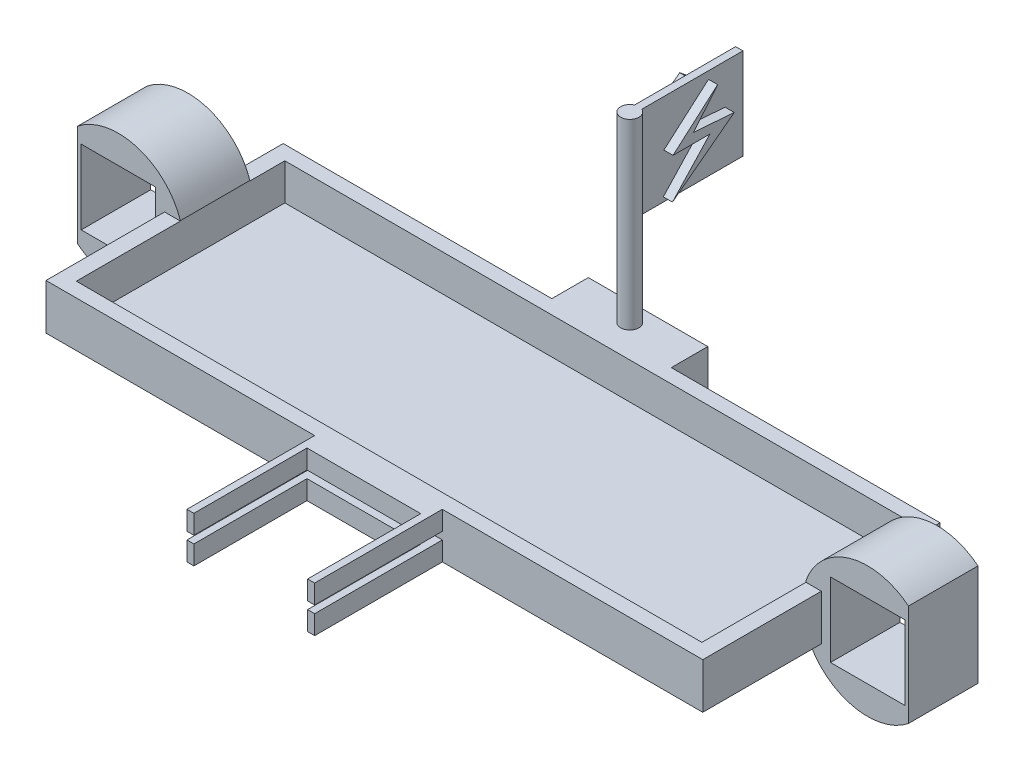
from build123d import *

# Parameters (mm, degrees)
SKETCH1_W            = 180
SKETCH1_H            = 65
SKETCH1_W_2          = 171.45
SKETCH1_H_2          = 57.15
BOSS_EXTRUDE1_DEPTH  = 10
SKETCH2_W            = 180
SKETCH2_H            = 65
BOSS_EXTRUDE2_DEPTH  = 2.5
SKETCH3_W            = 19.05
SKETCH3_H            = 4.647704017
SKETCH3_H_2          = 3.172295983
BOSS_EXTRUDE3_DEPTH  = 2.5
SKETCH4_W            = 2.440634246
SKETCH4_H            = 20.32
BOSS_EXTRUDE4_DEPTH  = 19.05
SKETCH5_W            = 19.05
SKETCH5_H            = 25.298590684
BOSS_EXTRUDE5_DEPTH  = 2.5
BOSS_EXTRUDE6_DEPTH  = 19.05
SKETCH7_W            = 35
SKETCH7_H            = 5.223578232
BOSS_EXTRUDE7_DEPTH  = 4
SKETCH8_W            = 1.900028328
SKETCH8_H            = 5.223578232
SKETCH8_W_2          = 1.933775308
BOSS_EXTRUDE8_DEPTH  = 35
SKETCH9_W            = 25.32
SKETCH9_H            = 2.501981816
BOSS_EXTRUDE9_DEPTH  = 19.05
SKETCH10_W           = 20.346164675
SKETCH10_H           = 20.35236298
SKETCH10_W_2         = 20.379365754
SKETCH10_H_2         = 20.32
BOSS_EXTRUDE10_DEPTH = 19.05
SKETCH11_W           = 21.053847509
SKETCH11_H           = 26.24333769
SKETCH11_W_2         = 20.65238494
SKETCH11_H_2         = 27.151183987
CUT_EXTRUDE1_DEPTH   = 219.146485719
SKETCH12_W           = 32.74513921
SKETCH12_H           = 12.5
BOSS_EXTRUDE11_DEPTH = 10
SKETCH13_R           = 2.5
BOSS_EXTRUDE12_DEPTH = 50
BOSS_EXTRUDE13_START = -25
BOSS_EXTRUDE13_DEPTH = 25
BOSS_EXTRUDE14_DEPTH = 2.5
BOSS_EXTRUDE15_DEPTH = 2.5


with BuildPart() as part:
    # Sketch1 → Boss-Extrude1 (new body)
    with BuildSketch(Plane(origin=(0, 0, 0), x_dir=(1, 0, 0), z_dir=(0, 1, 0))):
        with Locations((85.674229947, 28.51722294)):
            Rectangle(SKETCH1_W, SKETCH1_H)
        with Locations((85.725, 28.575)):
            Rectangle(SKETCH1_W_2, SKETCH1_H_2, mode=Mode.SUBTRACT)
    extrude(amount=BOSS_EXTRUDE1_DEPTH)

    # Sketch2 → Boss-Extrude2 (add)
    with BuildSketch(Plane(origin=(0, 0, 0), x_dir=(-1, 0, 0), z_dir=(0, -1, 0))):
        with Locations((-85.674229947, 28.51722294)):
            Rectangle(SKETCH2_W, SKETCH2_H)
    extrude(amount=BOSS_EXTRUDE2_DEPTH)

    # Sketch3 → Boss-Extrude3 (add)
    with BuildSketch(Plane(origin=(175.674229947, 0, 0), x_dir=(0, 0, -1), z_dir=(1, 0, 0))):
        with Locations((38.04222294, 12.323852009)):
            Rectangle(SKETCH3_W, SKETCH3_H)
        Polygon((28.51722294, 10), (28.51722294, 3.75), (28.51722294, -2.5), (47.56722294, -2.5), (47.56722294, 10), align=None)
        with Locations((38.04222294, -4.086147992)):
            Rectangle(SKETCH3_W, SKETCH3_H_2)
    extrude(amount=BOSS_EXTRUDE3_DEPTH)

    # Sketch4 → Boss-Extrude4 (add)
    with BuildSketch(Plane(origin=(0, 0, -47.56722294), x_dir=(-1, 0, 0), z_dir=(0, 0, -1))):
        Polygon((-200.994229947, 17.126484518), (-200.994229947, 14.647704017), (-198.553595701, 14.647704017), (-178.174229947, 14.647704017), (-175.674229947, 14.647704017), (-175.674229947, 17.126484518), align=None)
        with Locations((-199.773912824, 4.487704017)):
            Rectangle(SKETCH4_W, SKETCH4_H)
        Polygon((-198.553595701, -5.672295983), (-200.994229947, -5.672295983), (-200.994229947, -8.172106166), (-175.674229947, -8.172106166), (-175.674229947, -5.672295983), (-178.174229947, -5.672295983), align=None)
    extrude(amount=-BOSS_EXTRUDE4_DEPTH)

    # Sketch5 → Boss-Extrude5 (add)
    with BuildSketch(Plane.ZY.offset(4.325770053)):
        with Locations((-38.04222294, 4.477189176)):
            Rectangle(SKETCH5_W, SKETCH5_H)
    extrude(amount=BOSS_EXTRUDE5_DEPTH)

    # Sketch6 → Boss-Extrude6 (add)
    with BuildSketch(Plane.XY.offset(-28.51722294)):
        Polygon((-29.645770053, -8.172106166), (-27.171934728, -8.172106166), (-27.171934728, 14.68223863), (-4.325770053, 14.68223863), (-4.325770053, 17.115716116), (-29.645770053, 17.115716116), align=None)
    extrude(amount=-BOSS_EXTRUDE6_DEPTH)

    # Sketch7 → Boss-Extrude7 (add)
    with BuildSketch(Plane.XY.offset(3.98277706)):
        with Locations((86.801660342, 7.388210884)):
            Rectangle(SKETCH7_W, SKETCH7_H)
        with Locations((86.801660342, 0.111789116)):
            Rectangle(SKETCH7_W, SKETCH7_H)
    extrude(amount=BOSS_EXTRUDE7_DEPTH)

    # Sketch8 → Boss-Extrude8 (add)
    with BuildSketch(Plane.XY.offset(3.98277706)):
        with Locations((70.251674506, 7.388210884)):
            Rectangle(SKETCH8_W, SKETCH8_H)
        with Locations((70.251674506, 0.111789116)):
            Rectangle(SKETCH8_W, SKETCH8_H)
        with Locations((103.334772688, 0.111789116)):
            Rectangle(SKETCH8_W_2, SKETCH8_H)
        with Locations((103.334772688, 7.388210884)):
            Rectangle(SKETCH8_W_2, SKETCH8_H)
    extrude(amount=BOSS_EXTRUDE8_DEPTH)

    # Sketch9 → Boss-Extrude9 (add)
    with BuildSketch(Plane.XY.offset(-28.51722294)):
        with Locations((-16.985770053, -6.921115258)):
            Rectangle(SKETCH9_W, SKETCH9_H)
    extrude(amount=-BOSS_EXTRUDE9_DEPTH)

    # Sketch10 → Boss-Extrude10 (add)
    # profile 1 of 2: a face of its own
    with BuildSketch(Plane.XY.offset(-28.51722294)):
        with BuildLine():
            ThreePointArc((0, 10.117261054), (-34.872965087, 4.477189176), (0, -1.162882702))
            Line((0, -1.162882702), (0, 10.117261054))
        make_face()
        with Locations((-16.998852391, 4.50605714)):
            Rectangle(SKETCH10_W, SKETCH10_H, mode=Mode.SUBTRACT)
    # profile 2 of 2: a face of its own
    with BuildSketch(Plane.XY.offset(-28.51722294)):
        with BuildLine():
            Line((171.45, 10.410405146), (171.45, -1.456026794))
            ThreePointArc((171.45, -1.456026794), (206.230605911, 4.477189176), (171.45, 10.410405146))
        make_face()
        with Locations((188.363912824, 4.487704017)):
            Rectangle(SKETCH10_W_2, SKETCH10_H_2, mode=Mode.SUBTRACT)
    extrude(amount=-BOSS_EXTRUDE10_DEPTH)

    # Sketch11 → Cut-Extrude1 (cut, through all)
    with BuildSketch(Plane.XY.offset(-28.51722294)):
        with BuildLine():
            Line((-53.173508904, 4.50605714), (-34.8729418, 4.50605714))
            ThreePointArc((-34.8729418, 4.50605714), (-33.104696604, 12.232894836), (-28.171934728, 18.437616596))
            Line((-28.171934728, 18.437616596), (-28.171934728, 29.671454137))
            Line((-28.171934728, 29.671454137), (-53.381023661, 29.671454137))
            Line((-53.381023661, 29.671454137), (-53.381023661, 4.50605714))
            Line((-53.381023661, 4.50605714), (-53.173508904, 4.50605714))
        make_face()
        with BuildLine():
            ThreePointArc((-29.645770053, -8.161337764), (-33.520115813, -2.347890017), (-34.8729418, 4.50605714))
            Line((-34.8729418, 4.50605714), (-53.173508904, 4.50605714))
            Line((-53.173508904, 4.50605714), (-53.173508904, -18.45755641))
            Line((-53.173508904, -18.45755641), (-28.171934728, -18.45755641))
            Line((-28.171934728, -18.45755641), (-28.171934728, -9.483238244))
            ThreePointArc((-28.171934728, -9.483238244), (-28.921483903, -8.847768144), (-29.635015336, -8.172106166))
            Line((-29.635015336, -8.172106166), (-29.645770053, -8.172106166))
            Line((-29.645770053, -8.172106166), (-29.645770053, -8.161337764))
        make_face()
        with BuildLine():
            Line((-34.8729418, 4.50605714), (-28.171934728, 4.50605714))
            Line((-28.171934728, 4.50605714), (-28.171934728, 18.437616596))
            ThreePointArc((-28.171934728, 18.437616596), (-33.104696604, 12.232894836), (-34.8729418, 4.50605714))
        make_face()
        with BuildLine():
            Line((-28.171934728, -9.483238244), (-28.171934728, 4.50605714))
            Line((-28.171934728, 4.50605714), (-34.8729418, 4.50605714))
            ThreePointArc((-34.8729418, 4.50605714), (-33.520115813, -2.347890017), (-29.645770053, -8.161337764))
            Line((-29.645770053, -8.161337764), (-29.645770053, -8.172106166))
            Line((-29.645770053, -8.172106166), (-29.635015336, -8.172106166))
            ThreePointArc((-29.635015336, -8.172106166), (-28.921483903, -8.847768144), (-28.171934728, -9.483238244))
        make_face()
        with Locations((210.080519455, 17.609372862)):
            Rectangle(SKETCH11_W, SKETCH11_H)
        with Locations((209.879788171, -9.087887976)):
            Rectangle(SKETCH11_W_2, SKETCH11_H_2)
    extrude(amount=-CUT_EXTRUDE1_DEPTH, mode=Mode.SUBTRACT)

    # Sketch12 → Boss-Extrude11 (add)
    with BuildSketch(Plane(origin=(0, 0, -61.01722294), x_dir=(-1, 0, 0), z_dir=(0, 0, -1))):
        with Locations((-85.674229947, 3.75)):
            Rectangle(SKETCH12_W, SKETCH12_H)
    extrude(amount=BOSS_EXTRUDE11_DEPTH)

    # Sketch13 → Boss-Extrude12 (add)
    with BuildSketch(Plane(origin=(0, 10, 0), x_dir=(1, 0, 0), z_dir=(0, 1, 0))):
        with Locations(Location((85.674229947, 66.01722294, 0), (0, 0, 90))):
            Circle(SKETCH13_R)
    extrude(amount=BOSS_EXTRUDE12_DEPTH)

    # Sketch14 → Boss-Extrude13 (add)
    with BuildSketch(Plane(origin=(0, 60, 0), x_dir=(1, 0, 0), z_dir=(0, 1, 0)).offset(BOSS_EXTRUDE13_START)):
        with BuildLine():
            Line((84.674229947, 68.308510788), (84.674229947, 66.01722294))
            Line((84.674229947, 66.01722294), (86.674229947, 66.01722294))
            Line((86.674229947, 66.01722294), (86.674229947, 68.308510788))
            ThreePointArc((86.674229947, 68.308510788), (85.674229947, 68.51722294), (84.674229947, 68.308510788))
        make_face()
        with BuildLine():
            Line((86.674229947, 66.01722294), (84.674229947, 66.01722294))
            Line((84.674229947, 66.01722294), (84.674229947, 63.725935093))
            ThreePointArc((84.674229947, 63.725935093), (85.674229947, 63.51722294), (86.674229947, 63.725935093))
            Line((86.674229947, 63.725935093), (86.674229947, 66.01722294))
        make_face()
        with BuildLine():
            Line((84.674229947, 96.01722294), (84.674229947, 68.308510788))
            ThreePointArc((84.674229947, 68.308510788), (85.674229947, 68.51722294), (86.674229947, 68.308510788))
            Line((86.674229947, 68.308510788), (86.674229947, 96.01722294))
            Line((86.674229947, 96.01722294), (84.674229947, 96.01722294))
        make_face()
    extrude(amount=BOSS_EXTRUDE13_DEPTH)

    # Sketch15 → Boss-Extrude14 (add)
    with BuildSketch(Plane(origin=(86.674229947, 0, 0), x_dir=(0, 0, -1), z_dir=(1, 0, 0))):
        Polygon((86.590113791, 57.949199479), (74.364516101, 47.274610451), (84.462974004, 47.274610451), (74.205725369, 36.241603515), (91.143359189, 49.065886488), (80.020746684, 49.909078542), align=None)
    extrude(amount=BOSS_EXTRUDE14_DEPTH)

    # Sketch16 → Boss-Extrude15 (add)
    with BuildSketch(Plane.ZY.offset(-84.674229947)):
        Polygon((-88.831415439, 54.480665097), (-88.831415439, 49.480665097), (-83.207775472, 46.244467981), (-83.207775472, 41.244467981), (-88.831415439, 46.244467981), (-88.831415439, 41.244467981), (-83.320105395, 36.799352745), (-77.00848732, 41.244467981), (-77.00848732, 46.244467981), (-83.207775472, 49.480665097), (-83.207775472, 54.480665097), (-77.00848732, 49.480665097), (-77.00848732, 54.480665097), (-83.207775472, 58.956719844), align=None)
    extrude(amount=BOSS_EXTRUDE15_DEPTH)


solid = part.part
